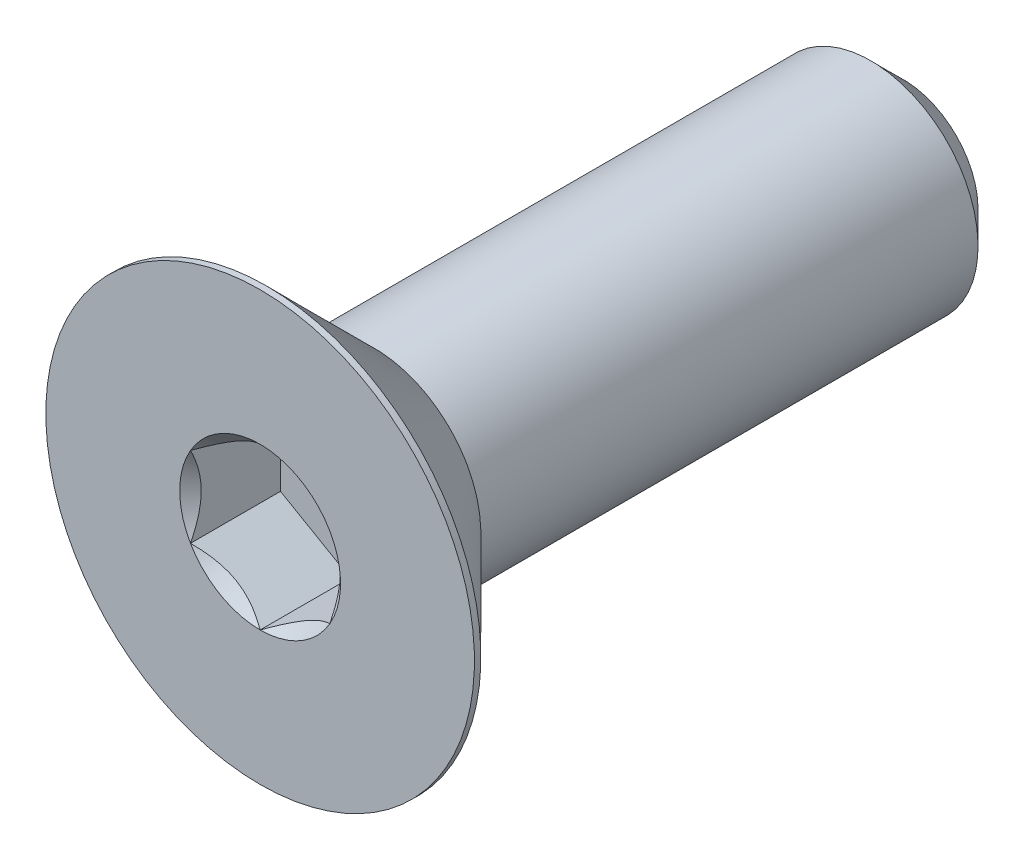
from build123d import *

# Parameters (mm, degrees)
CHAMFER1_SIZE      = 0.3
CUT_EXTRUDE2_DEPTH = 0.84


with BuildPart() as part:
    # Sketch1 → Revolve1 (revolve)
    with BuildSketch(Plane(origin=(0, 0, 0), x_dir=(0, 0, -1), z_dir=(1, 0, 0))):
        Polygon((-1.8, 1), (3, 1), (3, 0), (-2.16, 0), (-2.16, 1), align=None)
    revolve(axis=Axis((0, 0, 2.16), (0, 0, -1)))

    # Chamfer1
    chamfer1_edges = [part.edges().sort_by_distance(p)[0] for p in [
        (0, -1, -3),
    ]]
    chamfer(chamfer1_edges, length=CHAMFER1_SIZE)


with BuildPart() as body_2:
    # Sketch7 → Revolve2 (revolve)
    with BuildSketch(Plane(origin=(0, 0, 0), x_dir=(0, 0, -1), z_dir=(1, 0, 0))):
        Polygon((-2.94, 2), (-3, 2), (-3, 0), (-1.8, 0), (-1.8, 0.86), align=None)
    revolve(axis=Axis((0, 0, 3), (0, 0, -1)))

    # Sketch5 → Cut-Extrude2 (cut)
    with BuildSketch(Plane.XY.offset(3)):
        Polygon((0.65, -0.375277675), (0.65, 0.375277675), (0, 0.75055535), (-0.65, 0.375277675), (-0.65, -0.375277675), (0, -0.75055535), align=None)
    extrude(amount=-CUT_EXTRUDE2_DEPTH, mode=Mode.SUBTRACT)

    # Cut-Extrude3 cone 1 section (through the dimple's axis) → Cut-Extrude3 (revolve, cut)
    with BuildSketch(Plane(origin=(0, 0, 3), x_dir=(0, -1, 0), z_dir=(1, 0, 0))):
        Polygon((0, 0), (0.75055535, 0), (0, 0.75055535), align=None)
    revolve(axis=Axis((0, 0, 3), (0, 0, -1)), mode=Mode.SUBTRACT)


solid = Compound([part.part, body_2.part])
